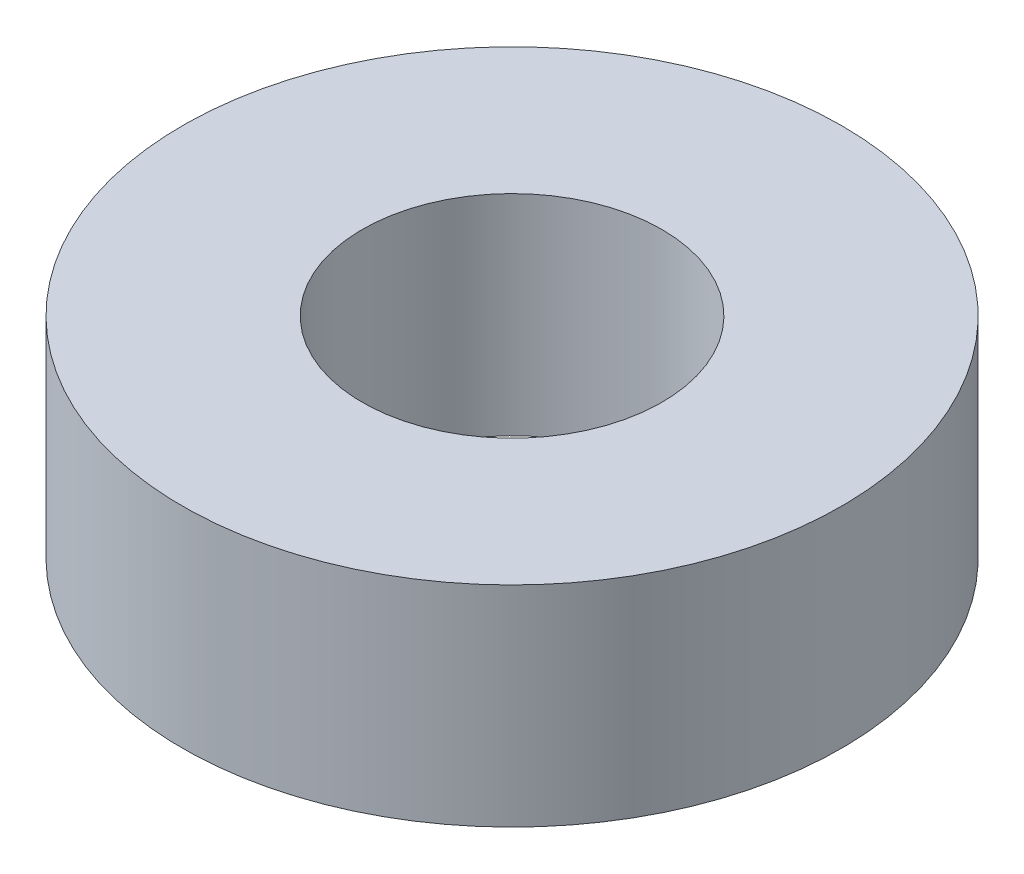
from build123d import *

# Parameters (mm, degrees)
SKETCH1_W = 6
SKETCH1_H = 7


with BuildPart() as part:
    # Sketch1 → Revolve1 (revolve)
    with BuildSketch(Plane.XY, mode=Mode.PRIVATE) as revolve1_sk:
        with Locations((8, 3.5)):
            Rectangle(SKETCH1_W, SKETCH1_H)
    revolve(revolve1_sk.sketch.rotate(Axis((0, 0, 0), (0, 1, 0)), 90), axis=Axis((0, 0, 0), (0, 1, 0)))


solid = part.part
